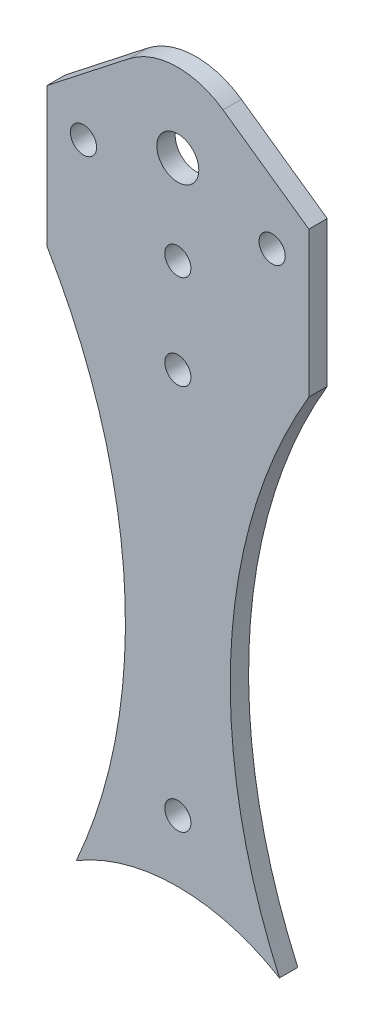
from build123d import *

# Parameters (mm, degrees)
SKETCH2_R           = 6.35
SKETCH2_R_2         = 3.175
SKETCH2_R_3         = 5.08
BOSS_EXTRUDE1_DEPTH = 4.445
SKETCH4_R           = 3.175
CUT_EXTRUDE2_DEPTH  = 148.450257689
SKETCH6_R           = 47.625
CUT_EXTRUDE3_DEPTH  = 148.450257689
CUT_EXTRUDE4_DEPTH  = 117.664246312


with BuildPart() as part:
    # Sketch2 → Boss-Extrude1 (new body)
    with BuildSketch(Plane.XY):
        with BuildLine():
            Line((31.75, 112.17275), (-31.75, 112.17275))
            Line((-31.75, 112.17275), (-31.75, 52.48275))
            ThreePointArc((-31.75, 52.48275), (-12.7, -17.145), (-31.75, -86.77275))
            Line((-31.75, -86.77275), (-31.75, -112.17275))
            ThreePointArc((-31.75, -112.17275), (0, -143.92275), (31.75, -112.17275))
            Line((31.75, -112.17275), (31.75, -86.77275))
            ThreePointArc((31.75, -86.77275), (12.7, -17.145), (31.75, 52.48275))
            Line((31.75, 52.48275), (31.75, 112.17275))
        make_face()
        with Locations((0, -112.17275)):
            Circle(SKETCH2_R, mode=Mode.SUBTRACT)
        with Locations((-22.86, 79.15275)):
            Circle(SKETCH2_R_2, mode=Mode.SUBTRACT)
        with Locations((0, 65.18275)):
            Circle(SKETCH2_R_2, mode=Mode.SUBTRACT)
        with Locations((0, 86.77275)):
            Circle(SKETCH2_R_3, mode=Mode.SUBTRACT)
        with Locations((22.86, 79.15275)):
            Circle(SKETCH2_R_2, mode=Mode.SUBTRACT)
    extrude(amount=BOSS_EXTRUDE1_DEPTH)

    # Sketch4 → Cut-Extrude2 (cut, through all)
    with BuildSketch(Plane.XY.offset(4.445)):
        with Locations((0, 42.32275)):
            Circle(SKETCH4_R)
        with Locations((0, -51.21275)):
            Circle(SKETCH4_R)
    extrude(amount=-CUT_EXTRUDE2_DEPTH, mode=Mode.SUBTRACT)

    # Sketch6 → Cut-Extrude3 (cut, through all)
    with BuildSketch(Plane.XY.offset(4.445)):
        with Locations((0, -113.76025)):
            Circle(SKETCH6_R)
    extrude(amount=-CUT_EXTRUDE3_DEPTH, mode=Mode.SUBTRACT)

    # Sketch10 → Cut-Extrude4 (cut, through all)
    with BuildSketch(Plane.XY.offset(4.445)):
        with BuildLine():
            Line((-31.75, 112.17275), (-31.75, 86.094442115))
            Line((-31.75, 86.094442115), (-11.750340751, 101.767148695))
            ThreePointArc((-11.750340751, 101.767148695), (-0.491450562, 105.816409741), (10.961308866, 102.353257307))
            Line((10.961308866, 102.353257307), (31.75, 87.727850063))
            Line((31.75, 87.727850063), (31.75, 112.17275))
            Line((31.75, 112.17275), (-31.75, 112.17275))
        make_face()
    extrude(amount=-CUT_EXTRUDE4_DEPTH, mode=Mode.SUBTRACT)


solid = part.part
